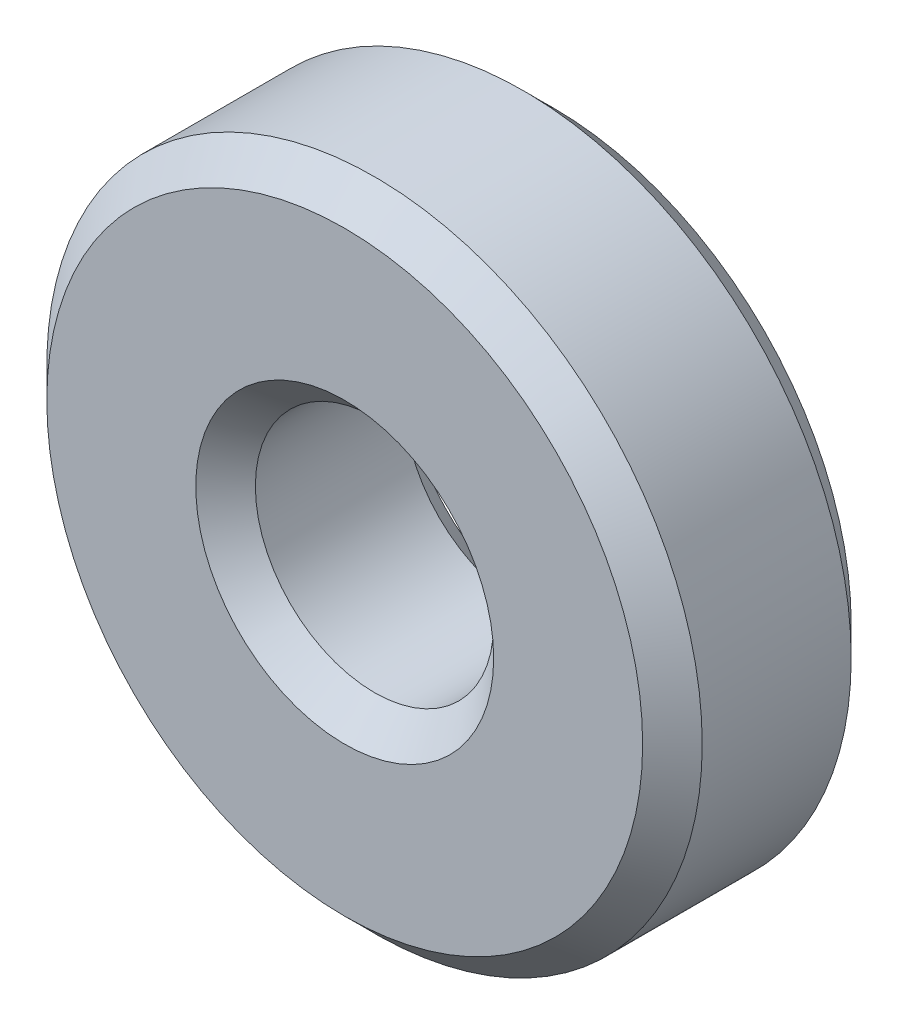
from build123d import *

# Parameters (mm, degrees)
SKICA1_R                = 11
SKICA1_R_2              = 4
P_IDAT_VYSUNUT_M1_DEPTH = 7
ZKOSEN_1_SIZE           = 1


with BuildPart() as part:
    # Skica1 → Přidat vysunutím1 (new body)
    with BuildSketch(Plane.XY):
        Circle(SKICA1_R)
        Circle(SKICA1_R_2, mode=Mode.SUBTRACT)
    extrude(amount=P_IDAT_VYSUNUT_M1_DEPTH)

    # Zkosení1
    zkosen_1_edges = [part.edges().sort_by_distance(p)[0] for p in [
        (-11, 0, 0),
        (-11, 0, 7),
        (-4, 0, 0),
        (-4, 0, 7),
    ]]
    chamfer(zkosen_1_edges, length=ZKOSEN_1_SIZE)


solid = part.part
